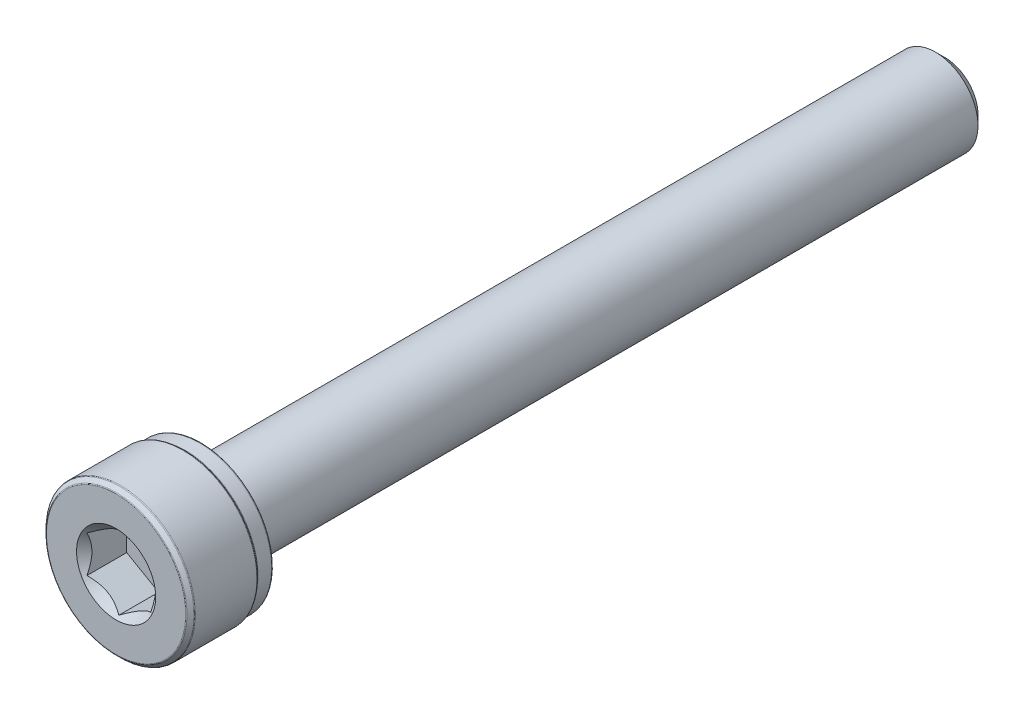
from build123d import *

# Parameters (mm, degrees)
CUT_EXTRUDE1_START = -2
CUT_EXTRUDE1_DEPTH = 2


with BuildPart() as part:
    # Sketch2 → Revolve1 (revolve)
    with BuildSketch(Plane(origin=(0, 0, 0), x_dir=(0, 0, -1), z_dir=(1, 0, 0))):
        with BuildLine():
            Line((-19.5, 0), (-19.5, 3.274111652))
            ThreePointArc((-19.5, 3.274111652), (-19.495242471, 3.298029367), (-19.481694174, 3.318305826))
            Line((-19.481694174, 3.318305826), (-19.318305826, 3.481694174))
            ThreePointArc((-19.318305826, 3.481694174), (-19.298029367, 3.495242471), (-19.274111652, 3.5))
            Line((-19.274111652, 3.5), (-16.375888348, 3.5))
            ThreePointArc((-16.375888348, 3.5), (-16.351970633, 3.495242471), (-16.331694174, 3.481694174))
            Line((-16.331694174, 3.481694174), (-16.268305826, 3.418305826))
            ThreePointArc((-16.268305826, 3.418305826), (-16.248029367, 3.404757529), (-16.224111652, 3.4))
            Line((-16.224111652, 3.4), (-15.5875, 3.4))
            ThreePointArc((-15.5875, 3.4), (-15.525628157, 3.374371843), (-15.5, 3.3125))
            Line((-15.5, 3.3125), (-15.5, 2.2))
            ThreePointArc((-15.5, 2.2), (-15.441421356, 2.058578644), (-15.3, 2))
            Line((-15.3, 2), (19.045336663, 2))
            Line((19.045336663, 2), (19.5, 1.545336663))
            Line((19.5, 1.545336663), (19.5, 0))
            Line((19.5, 0), (-19.5, 0))
        make_face()
    revolve(axis=Axis((0, 0, -19.5), (0, 0, 1)))

    # Sketch3 → Cut-Extrude1 (cut)
    with BuildSketch(Plane.XY.offset(19.5).offset(CUT_EXTRUDE1_START)):
        Polygon((1.5, -0.866025404), (1.5, 0.866025404), (0, 1.732050808), (-1.5, 0.866025404), (-1.5, -0.866025404), (0, -1.732050808), align=None)
    extrude(amount=CUT_EXTRUDE1_DEPTH, mode=Mode.SUBTRACT)

    # Cut-Extrude2 cone 1 section (through the dimple's axis) → Cut-Extrude2 (revolve, cut)
    with BuildSketch(Plane(origin=(0, 0, 19.5), x_dir=(0, -1, 0), z_dir=(1, 0, 0))):
        Polygon((0, 0), (1.861954618, 0), (0, 1.861954618), align=None)
    revolve(axis=Axis((0, 0, 19.5), (0, 0, -1)), mode=Mode.SUBTRACT)


solid = part.part
